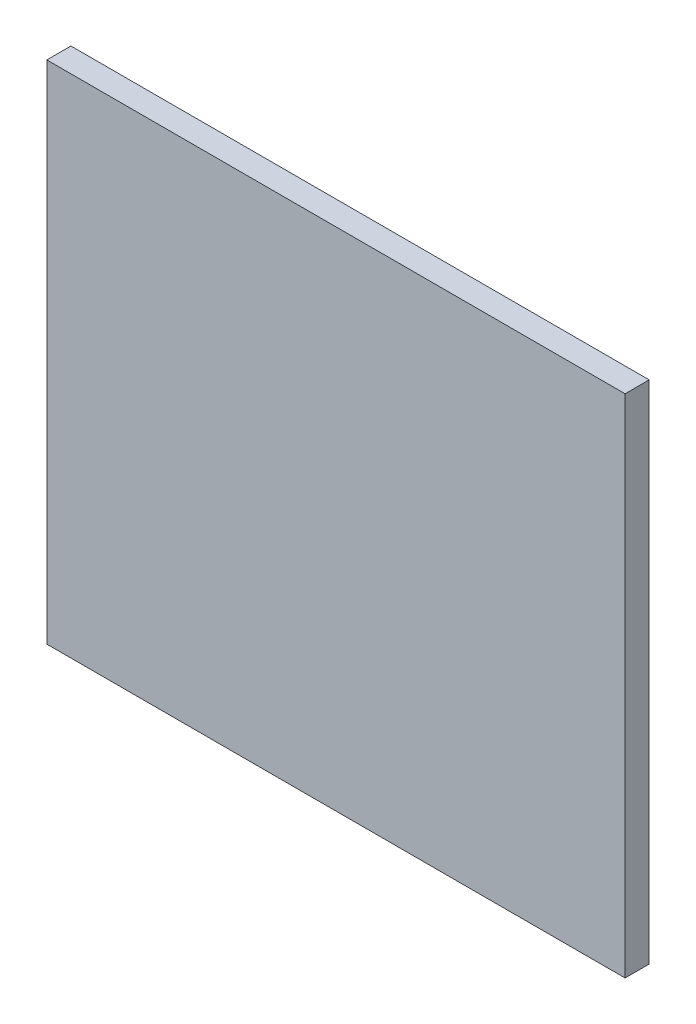
from build123d import *

# Parameters (mm, degrees)
CROQUIS1_W              = 240
CROQUIS1_H              = 210
SALIENTE_EXTRUIR1_DEPTH = 10


with BuildPart() as part:
    # Croquis1 → Saliente-Extruir1 (new body)
    with BuildSketch(Plane.XY):
        with Locations((120, 105)):
            Rectangle(CROQUIS1_W, CROQUIS1_H)
    extrude(amount=SALIENTE_EXTRUIR1_DEPTH)


solid = part.part
